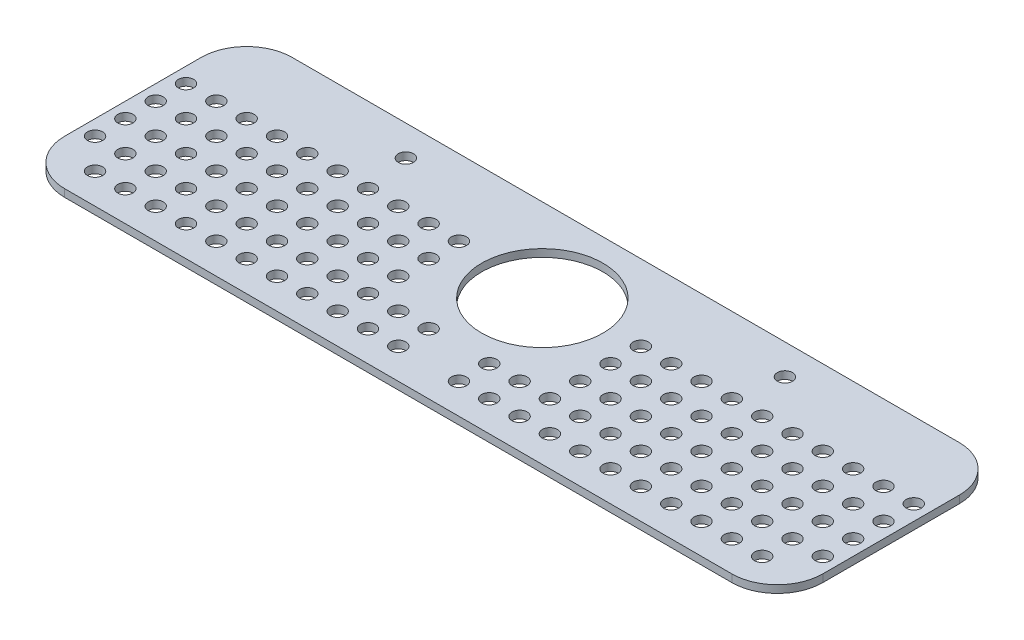
from build123d import *

# Parameters (mm, degrees)
SKETCH1_R           = 40
SKETCH1_R_2         = 5
BOSS_EXTRUDE1_DEPTH = 5


with BuildPart() as part:
    # Sketch1 → Boss-Extrude1 (new body)
    with BuildSketch(Plane(origin=(0, 0, 0), x_dir=(1, 0, 0), z_dir=(0, 1, 0))):
        with BuildLine():
            Line((220, -75), (-220, -75))
            ThreePointArc((-220, -75), (-241.213203436, -66.213203436), (-250, -45))
            Line((-250, -45), (-250, 45))
            ThreePointArc((-250, 45), (-241.213203436, 66.213203436), (-220, 75))
            Line((-220, 75), (220, 75))
            ThreePointArc((220, 75), (241.213203436, 66.213203436), (250, 45))
            Line((250, 45), (250, -45))
            ThreePointArc((250, -45), (241.213203436, -66.213203436), (220, -75))
        make_face()
        with Locations(Location((0, 20, 0), (0, 0, 270))):
            Circle(SKETCH1_R, mode=Mode.SUBTRACT)
        with Locations(Location((-125, 55, 0), (0, 0, 270))):
            Circle(SKETCH1_R_2, mode=Mode.SUBTRACT)
        with Locations(Location((125, 55, 0), (0, 0, 270))):
            Circle(SKETCH1_R_2, mode=Mode.SUBTRACT)
        with Locations(Location((-240, 25, 0), (0, 0, 270))):
            Circle(SKETCH1_R_2, mode=Mode.SUBTRACT)
        with Locations(Location((-220, 25, 0), (0, 0, 270))):
            Circle(SKETCH1_R_2, mode=Mode.SUBTRACT)
        with Locations(Location((-200, 25, 0), (0, 0, 270))):
            Circle(SKETCH1_R_2, mode=Mode.SUBTRACT)
        with Locations(Location((-180, 25, 0), (0, 0, 270))):
            Circle(SKETCH1_R_2, mode=Mode.SUBTRACT)
        with Locations(Location((-160, 25, 0), (0, 0, 270))):
            Circle(SKETCH1_R_2, mode=Mode.SUBTRACT)
        with Locations(Location((-140, 25, 0), (0, 0, 270))):
            Circle(SKETCH1_R_2, mode=Mode.SUBTRACT)
        with Locations(Location((-120, 25, 0), (0, 0, 270))):
            Circle(SKETCH1_R_2, mode=Mode.SUBTRACT)
        with Locations(Location((-100, 25, 0), (0, 0, 270))):
            Circle(SKETCH1_R_2, mode=Mode.SUBTRACT)
        with Locations(Location((-80, 25, 0), (0, 0, 270))):
            Circle(SKETCH1_R_2, mode=Mode.SUBTRACT)
        with Locations(Location((-60, 25, 0), (0, 0, 270))):
            Circle(SKETCH1_R_2, mode=Mode.SUBTRACT)
        with Locations(Location((-240, 5, 0), (0, 0, 270))):
            Circle(SKETCH1_R_2, mode=Mode.SUBTRACT)
        with Locations(Location((-220, 5, 0), (0, 0, 270))):
            Circle(SKETCH1_R_2, mode=Mode.SUBTRACT)
        with Locations(Location((-200, 5, 0), (0, 0, 270))):
            Circle(SKETCH1_R_2, mode=Mode.SUBTRACT)
        with Locations(Location((-180, 5, 0), (0, 0, 270))):
            Circle(SKETCH1_R_2, mode=Mode.SUBTRACT)
        with Locations(Location((-160, 5, 0), (0, 0, 270))):
            Circle(SKETCH1_R_2, mode=Mode.SUBTRACT)
        with Locations(Location((-140, 5, 0), (0, 0, 270))):
            Circle(SKETCH1_R_2, mode=Mode.SUBTRACT)
        with Locations(Location((-120, 5, 0), (0, 0, 270))):
            Circle(SKETCH1_R_2, mode=Mode.SUBTRACT)
        with Locations(Location((-100, 5, 0), (0, 0, 270))):
            Circle(SKETCH1_R_2, mode=Mode.SUBTRACT)
        with Locations(Location((-80, 5, 0), (0, 0, 270))):
            Circle(SKETCH1_R_2, mode=Mode.SUBTRACT)
        with Locations(Location((-60, 5, 0), (0, 0, 270))):
            Circle(SKETCH1_R_2, mode=Mode.SUBTRACT)
        with Locations(Location((-240, -15, 0), (0, 0, 270))):
            Circle(SKETCH1_R_2, mode=Mode.SUBTRACT)
        with Locations(Location((-220, -15, 0), (0, 0, 270))):
            Circle(SKETCH1_R_2, mode=Mode.SUBTRACT)
        with Locations(Location((-200, -15, 0), (0, 0, 270))):
            Circle(SKETCH1_R_2, mode=Mode.SUBTRACT)
        with Locations(Location((-180, -15, 0), (0, 0, 270))):
            Circle(SKETCH1_R_2, mode=Mode.SUBTRACT)
        with Locations(Location((-160, -15, 0), (0, 0, 270))):
            Circle(SKETCH1_R_2, mode=Mode.SUBTRACT)
        with Locations(Location((-140, -15, 0), (0, 0, 270))):
            Circle(SKETCH1_R_2, mode=Mode.SUBTRACT)
        with Locations(Location((-120, -15, 0), (0, 0, 270))):
            Circle(SKETCH1_R_2, mode=Mode.SUBTRACT)
        with Locations(Location((-100, -15, 0), (0, 0, 270))):
            Circle(SKETCH1_R_2, mode=Mode.SUBTRACT)
        with Locations(Location((-80, -15, 0), (0, 0, 270))):
            Circle(SKETCH1_R_2, mode=Mode.SUBTRACT)
        with Locations(Location((-60, -15, 0), (0, 0, 270))):
            Circle(SKETCH1_R_2, mode=Mode.SUBTRACT)
        with Locations(Location((-240, -35, 0), (0, 0, 270))):
            Circle(SKETCH1_R_2, mode=Mode.SUBTRACT)
        with Locations(Location((-220, -35, 0), (0, 0, 270))):
            Circle(SKETCH1_R_2, mode=Mode.SUBTRACT)
        with Locations(Location((-200, -35, 0), (0, 0, 270))):
            Circle(SKETCH1_R_2, mode=Mode.SUBTRACT)
        with Locations(Location((-180, -35, 0), (0, 0, 270))):
            Circle(SKETCH1_R_2, mode=Mode.SUBTRACT)
        with Locations(Location((-160, -35, 0), (0, 0, 270))):
            Circle(SKETCH1_R_2, mode=Mode.SUBTRACT)
        with Locations(Location((-140, -35, 0), (0, 0, 270))):
            Circle(SKETCH1_R_2, mode=Mode.SUBTRACT)
        with Locations(Location((-120, -35, 0), (0, 0, 270))):
            Circle(SKETCH1_R_2, mode=Mode.SUBTRACT)
        with Locations(Location((-100, -35, 0), (0, 0, 270))):
            Circle(SKETCH1_R_2, mode=Mode.SUBTRACT)
        with Locations(Location((-80, -35, 0), (0, 0, 270))):
            Circle(SKETCH1_R_2, mode=Mode.SUBTRACT)
        with Locations(Location((-60, -35, 0), (0, 0, 270))):
            Circle(SKETCH1_R_2, mode=Mode.SUBTRACT)
        with Locations(Location((-220, -55, 0), (0, 0, 270))):
            Circle(SKETCH1_R_2, mode=Mode.SUBTRACT)
        with Locations(Location((-200, -55, 0), (0, 0, 270))):
            Circle(SKETCH1_R_2, mode=Mode.SUBTRACT)
        with Locations(Location((-180, -55, 0), (0, 0, 270))):
            Circle(SKETCH1_R_2, mode=Mode.SUBTRACT)
        with Locations(Location((-160, -55, 0), (0, 0, 270))):
            Circle(SKETCH1_R_2, mode=Mode.SUBTRACT)
        with Locations(Location((-140, -55, 0), (0, 0, 270))):
            Circle(SKETCH1_R_2, mode=Mode.SUBTRACT)
        with Locations(Location((-120, -55, 0), (0, 0, 270))):
            Circle(SKETCH1_R_2, mode=Mode.SUBTRACT)
        with Locations(Location((-100, -55, 0), (0, 0, 270))):
            Circle(SKETCH1_R_2, mode=Mode.SUBTRACT)
        with Locations(Location((-80, -55, 0), (0, 0, 270))):
            Circle(SKETCH1_R_2, mode=Mode.SUBTRACT)
        with Locations(Location((-60, -55, 0), (0, 0, 270))):
            Circle(SKETCH1_R_2, mode=Mode.SUBTRACT)
        with Locations(Location((-40, -35, 0), (0, 0, 270))):
            Circle(SKETCH1_R_2, mode=Mode.SUBTRACT)
        with Locations(Location((-40, -55, 0), (0, 0, 270))):
            Circle(SKETCH1_R_2, mode=Mode.SUBTRACT)
        with Locations(Location((-20, -35, 0), (0, 0, 270))):
            Circle(SKETCH1_R_2, mode=Mode.SUBTRACT)
        with Locations(Location((-20, -55, 0), (0, 0, 270))):
            Circle(SKETCH1_R_2, mode=Mode.SUBTRACT)
        with Locations(Location((20, -55, 0), (0, 0, 270))):
            Circle(SKETCH1_R_2, mode=Mode.SUBTRACT)
        with Locations(Location((40, -55, 0), (0, 0, 270))):
            Circle(SKETCH1_R_2, mode=Mode.SUBTRACT)
        with Locations(Location((60, -55, 0), (0, 0, 270))):
            Circle(SKETCH1_R_2, mode=Mode.SUBTRACT)
        with Locations(Location((80, -55, 0), (0, 0, 270))):
            Circle(SKETCH1_R_2, mode=Mode.SUBTRACT)
        with Locations(Location((100, -55, 0), (0, 0, 270))):
            Circle(SKETCH1_R_2, mode=Mode.SUBTRACT)
        with Locations(Location((120, -55, 0), (0, 0, 270))):
            Circle(SKETCH1_R_2, mode=Mode.SUBTRACT)
        with Locations(Location((140, -55, 0), (0, 0, 270))):
            Circle(SKETCH1_R_2, mode=Mode.SUBTRACT)
        with Locations(Location((120, -35, 0), (0, 0, 270))):
            Circle(SKETCH1_R_2, mode=Mode.SUBTRACT)
        with Locations(Location((100, -35, 0), (0, 0, 270))):
            Circle(SKETCH1_R_2, mode=Mode.SUBTRACT)
        with Locations(Location((80, -35, 0), (0, 0, 270))):
            Circle(SKETCH1_R_2, mode=Mode.SUBTRACT)
        with Locations(Location((60, -35, 0), (0, 0, 270))):
            Circle(SKETCH1_R_2, mode=Mode.SUBTRACT)
        with Locations(Location((20, -35, 0), (0, 0, 270))):
            Circle(SKETCH1_R_2, mode=Mode.SUBTRACT)
        with Locations(Location((40, -35, 0), (0, 0, 270))):
            Circle(SKETCH1_R_2, mode=Mode.SUBTRACT)
        with Locations(Location((60, -15, 0), (0, 0, 270))):
            Circle(SKETCH1_R_2, mode=Mode.SUBTRACT)
        with Locations(Location((80, -15, 0), (0, 0, 270))):
            Circle(SKETCH1_R_2, mode=Mode.SUBTRACT)
        with Locations(Location((100, -15, 0), (0, 0, 270))):
            Circle(SKETCH1_R_2, mode=Mode.SUBTRACT)
        with Locations(Location((120, -15, 0), (0, 0, 270))):
            Circle(SKETCH1_R_2, mode=Mode.SUBTRACT)
        with Locations(Location((120, 5, 0), (0, 0, 270))):
            Circle(SKETCH1_R_2, mode=Mode.SUBTRACT)
        with Locations(Location((100, 5, 0), (0, 0, 270))):
            Circle(SKETCH1_R_2, mode=Mode.SUBTRACT)
        with Locations(Location((80, 5, 0), (0, 0, 270))):
            Circle(SKETCH1_R_2, mode=Mode.SUBTRACT)
        with Locations(Location((60, 5, 0), (0, 0, 270))):
            Circle(SKETCH1_R_2, mode=Mode.SUBTRACT)
        with Locations(Location((60, 25, 0), (0, 0, 270))):
            Circle(SKETCH1_R_2, mode=Mode.SUBTRACT)
        with Locations(Location((80, 25, 0), (0, 0, 270))):
            Circle(SKETCH1_R_2, mode=Mode.SUBTRACT)
        with Locations(Location((100, 25, 0), (0, 0, 270))):
            Circle(SKETCH1_R_2, mode=Mode.SUBTRACT)
        with Locations(Location((120, 25, 0), (0, 0, 270))):
            Circle(SKETCH1_R_2, mode=Mode.SUBTRACT)
        with Locations(Location((140, 25, 0), (0, 0, 270))):
            Circle(SKETCH1_R_2, mode=Mode.SUBTRACT)
        with Locations(Location((140, 5, 0), (0, 0, 270))):
            Circle(SKETCH1_R_2, mode=Mode.SUBTRACT)
        with Locations(Location((140, -15, 0), (0, 0, 270))):
            Circle(SKETCH1_R_2, mode=Mode.SUBTRACT)
        with Locations(Location((140, -35, 0), (0, 0, 270))):
            Circle(SKETCH1_R_2, mode=Mode.SUBTRACT)
        with Locations(Location((160, -55, 0), (0, 0, 270))):
            Circle(SKETCH1_R_2, mode=Mode.SUBTRACT)
        with Locations(Location((160, 5, 0), (0, 0, 270))):
            Circle(SKETCH1_R_2, mode=Mode.SUBTRACT)
        with Locations(Location((160, -15, 0), (0, 0, 270))):
            Circle(SKETCH1_R_2, mode=Mode.SUBTRACT)
        with Locations(Location((160, -35, 0), (0, 0, 270))):
            Circle(SKETCH1_R_2, mode=Mode.SUBTRACT)
        with Locations(Location((180, -55, 0), (0, 0, 270))):
            Circle(SKETCH1_R_2, mode=Mode.SUBTRACT)
        with Locations(Location((180, -35, 0), (0, 0, 270))):
            Circle(SKETCH1_R_2, mode=Mode.SUBTRACT)
        with Locations(Location((180, -15, 0), (0, 0, 270))):
            Circle(SKETCH1_R_2, mode=Mode.SUBTRACT)
        with Locations(Location((180, 5, 0), (0, 0, 270))):
            Circle(SKETCH1_R_2, mode=Mode.SUBTRACT)
        with Locations(Location((160, 25, 0), (0, 0, 270))):
            Circle(SKETCH1_R_2, mode=Mode.SUBTRACT)
        with Locations(Location((180, 25, 0), (0, 0, 270))):
            Circle(SKETCH1_R_2, mode=Mode.SUBTRACT)
        with Locations(Location((200, -55, 0), (0, 0, 270))):
            Circle(SKETCH1_R_2, mode=Mode.SUBTRACT)
        with Locations(Location((200, -15, 0), (0, 0, 270))):
            Circle(SKETCH1_R_2, mode=Mode.SUBTRACT)
        with Locations(Location((200, -35, 0), (0, 0, 270))):
            Circle(SKETCH1_R_2, mode=Mode.SUBTRACT)
        with Locations(Location((220, -55, 0), (0, 0, 270))):
            Circle(SKETCH1_R_2, mode=Mode.SUBTRACT)
        with Locations(Location((220, -35, 0), (0, 0, 270))):
            Circle(SKETCH1_R_2, mode=Mode.SUBTRACT)
        with Locations(Location((220, -15, 0), (0, 0, 270))):
            Circle(SKETCH1_R_2, mode=Mode.SUBTRACT)
        with Locations(Location((240, -35, 0), (0, 0, 270))):
            Circle(SKETCH1_R_2, mode=Mode.SUBTRACT)
        with Locations(Location((240, -15, 0), (0, 0, 270))):
            Circle(SKETCH1_R_2, mode=Mode.SUBTRACT)
        with Locations(Location((240, 5, 0), (0, 0, 270))):
            Circle(SKETCH1_R_2, mode=Mode.SUBTRACT)
        with Locations(Location((220, 5, 0), (0, 0, 270))):
            Circle(SKETCH1_R_2, mode=Mode.SUBTRACT)
        with Locations(Location((200, 5, 0), (0, 0, 270))):
            Circle(SKETCH1_R_2, mode=Mode.SUBTRACT)
        with Locations(Location((200, 25, 0), (0, 0, 270))):
            Circle(SKETCH1_R_2, mode=Mode.SUBTRACT)
        with Locations(Location((220, 25, 0), (0, 0, 270))):
            Circle(SKETCH1_R_2, mode=Mode.SUBTRACT)
        with Locations(Location((240, 25, 0), (0, 0, 270))):
            Circle(SKETCH1_R_2, mode=Mode.SUBTRACT)
    extrude(amount=BOSS_EXTRUDE1_DEPTH)


solid = part.part
